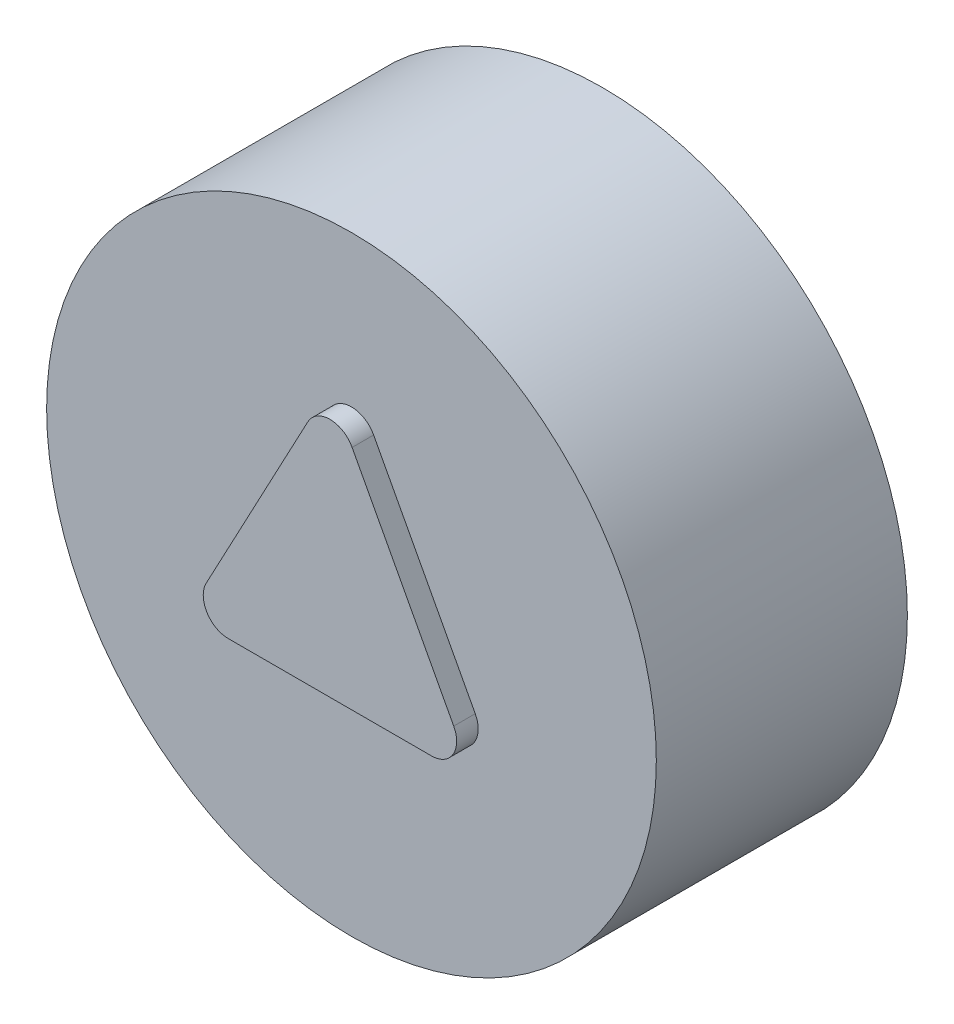
from build123d import *

# Parameters (mm, degrees)
SKETCH1_R           = 8.5
BOSS_EXTRUDE1_DEPTH = 7
BOSS_EXTRUDE2_DEPTH = 0.6
SKETCH3_R           = 5.8
CUT_EXTRUDE1_DEPTH  = 4.15


with BuildPart() as part:
    # Sketch1 → Boss-Extrude1 (new body)
    with BuildSketch(Plane.XY):
        Circle(SKETCH1_R)
    extrude(amount=BOSS_EXTRUDE1_DEPTH)

    # Sketch2 → Boss-Extrude2 (add)
    with BuildSketch(Plane.XY.offset(7)):
        with BuildLine():
            Line((-3.450980392, -1.394716626), (-0.617647059, 3.917783374))
            ThreePointArc((-0.617647059, 3.917783374), (0, 4.28837161), (0.617647059, 3.917783374))
            Line((0.617647059, 3.917783374), (3.450980392, -1.394716626))
            ThreePointArc((3.450980392, -1.394716626), (3.433578381, -2.084275419), (2.833333333, -2.42412839))
            Line((2.833333333, -2.42412839), (-2.833333333, -2.42412839))
            ThreePointArc((-2.833333333, -2.42412839), (-3.433578381, -2.084275419), (-3.450980392, -1.394716626))
        make_face()
    extrude(amount=BOSS_EXTRUDE2_DEPTH)

    # Sketch3 → Cut-Extrude1 (cut)
    with BuildSketch(Plane(origin=(0, 0, 0), x_dir=(-1, 0, 0), z_dir=(0, 0, -1))):
        Circle(SKETCH3_R)
    extrude(amount=-CUT_EXTRUDE1_DEPTH, mode=Mode.SUBTRACT)


solid = part.part
